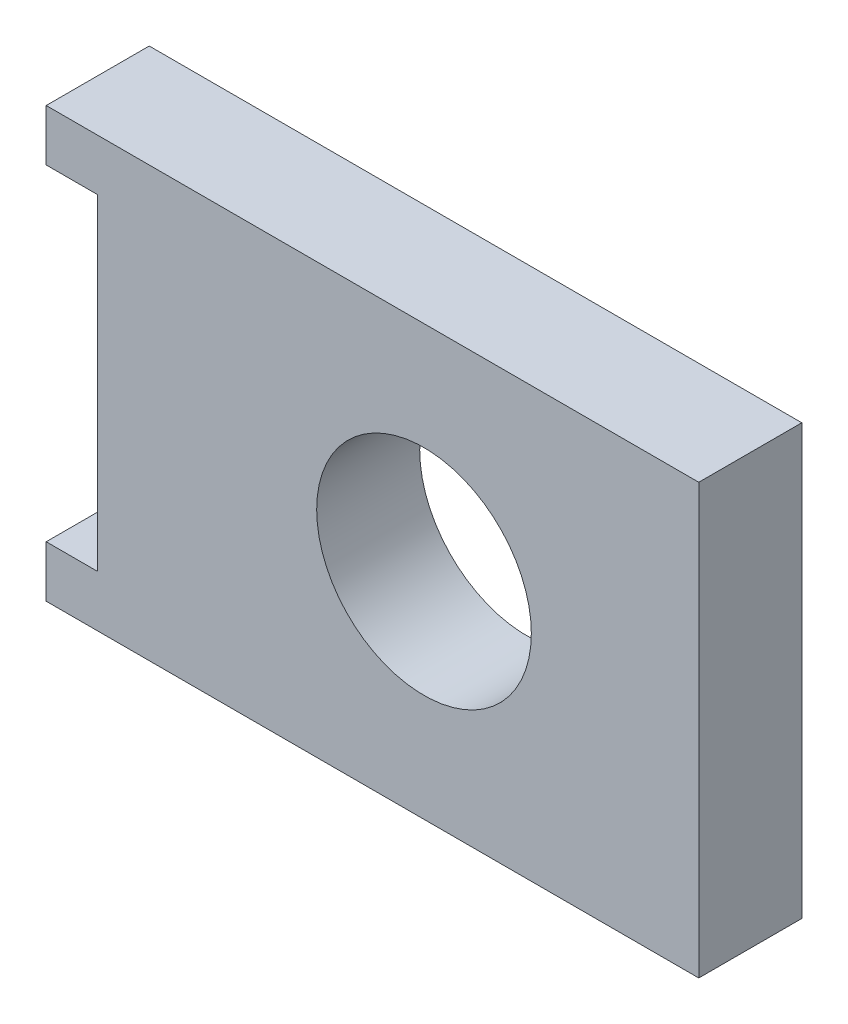
from build123d import *

# Parameters (mm, degrees)
SKETCH1_R           = 6.25
BOSS_EXTRUDE1_DEPTH = 6


with BuildPart() as part:
    # Sketch1 → Boss-Extrude1 (new body)
    with BuildSketch(Plane.XY):
        Polygon((-22, 9.5), (-19, 9.5), (-19, -9.5), (-22, -9.5), (-22, -12.5), (16, -12.5), (16, 12.5), (-22, 12.5), align=None)
        Circle(SKETCH1_R, mode=Mode.SUBTRACT)
    extrude(amount=BOSS_EXTRUDE1_DEPTH)


solid = part.part
